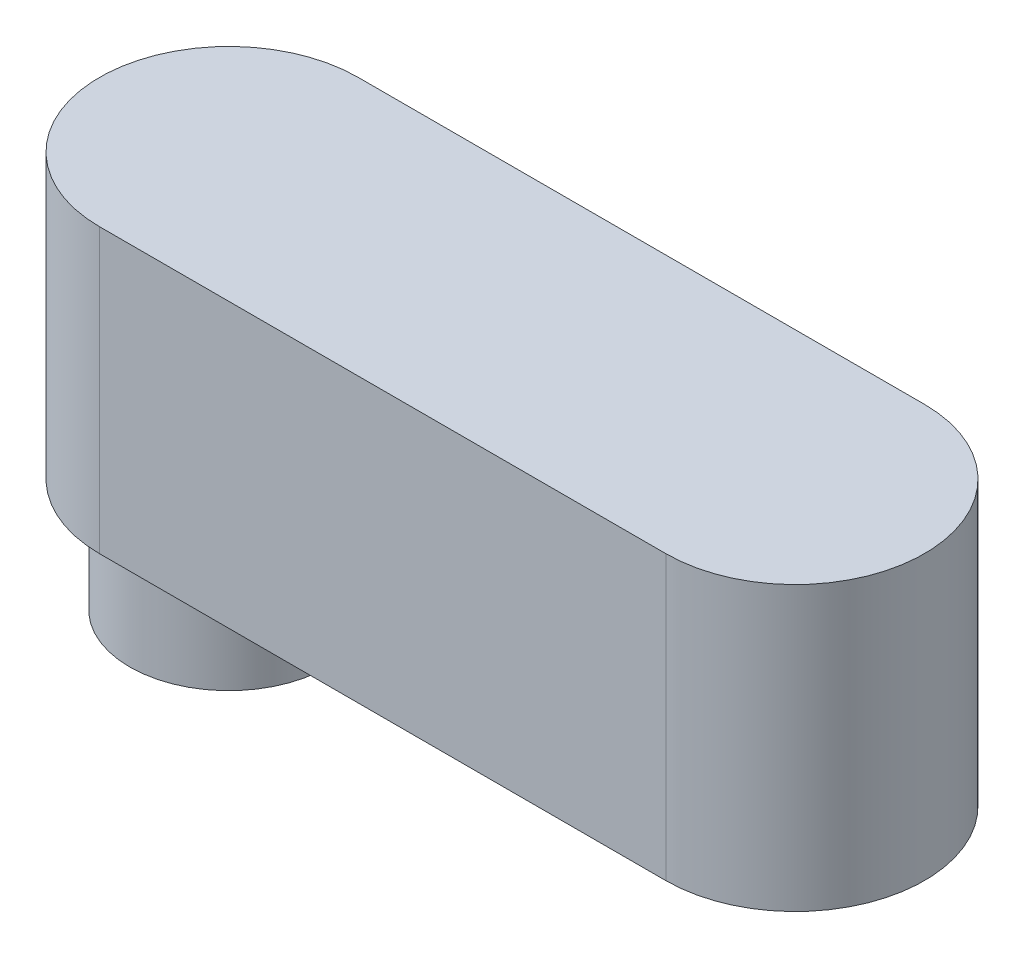
from build123d import *

# Parameters (mm, degrees)
RESSALTO_EXTRUS_O1_DEPTH = 10
ESBO_O2_R                = 3.5
RESSALTO_EXTRUS_O2_DEPTH = 4


with BuildPart() as part:
    # Esboço1 → Ressalto-extrusão1 (new body)
    with BuildSketch(Plane(origin=(0, 0, 0), x_dir=(1, 0, 0), z_dir=(0, 1, 0))):
        with BuildLine():
            Line((0, 0), (20, 0))
            ThreePointArc((20, 0), (24.566666667, -4.566666667), (20, -9.133333333))
            Line((20, -9.133333333), (0, -9.133333333))
            ThreePointArc((0, -9.133333333), (-4.566666667, -4.566666667), (0, 0))
        make_face()
    extrude(amount=RESSALTO_EXTRUS_O1_DEPTH)

    # Esboço2 → Ressalto-extrusão2 (add)
    with BuildSketch(Plane(origin=(0, 0, 0), x_dir=(1, 0, 0), z_dir=(0, 1, 0))):
        with Locations(Location((0, -4.566666667, 0), (0, 0, 270))):
            Circle(ESBO_O2_R)
    extrude(amount=-RESSALTO_EXTRUS_O2_DEPTH)


solid = part.part
